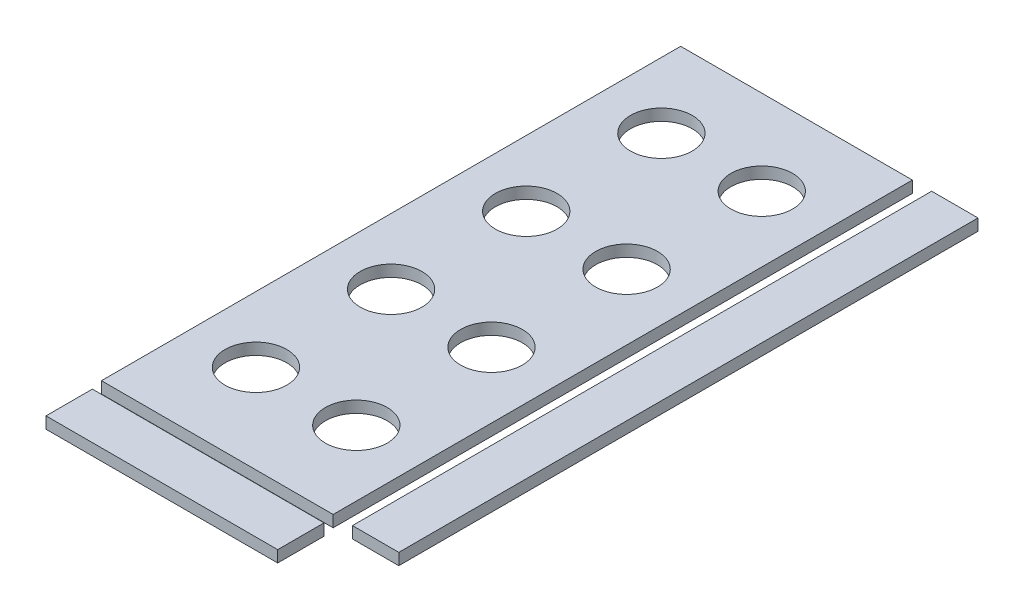
from build123d import *

# Parameters (mm, degrees)
SKETCH1_W             = 60
SKETCH1_H             = 150
BOSS_EXTRUDE2_DEPTH   = 3
SKETCH2_W             = 12
SKETCH2_H             = 150
BOSS_EXTRUDE4_DEPTH   = 3
SKETCH3_W             = 12
SKETCH3_H             = 60
BOSS_EXTRUDE5_DEPTH   = 3
SKETCH4_R             = 8
CUT_EXTRUDE1_DEPTH    = 3
BODY_MOVE_COPY1_ANGLE = 90


with BuildPart() as part:
    # Sketch1 → Boss-Extrude2 (new body)
    with BuildSketch(Plane(origin=(0, 0, 0), x_dir=(1, 0, 0), z_dir=(0, 1, 0))):
        with Locations((-8.377535101, 62.644305772)):
            Rectangle(SKETCH1_W, SKETCH1_H)
    extrude(amount=BOSS_EXTRUDE2_DEPTH)

    # Sketch4 → Cut-Extrude1 (cut)
    with BuildSketch(Plane(origin=(0, 3, 0), x_dir=(1, 0, 0), z_dir=(0, 1, 0))):
        with Locations(Location((4.622464899, 10.644305772, 0), (0, 0, 270))):
            Circle(SKETCH4_R)
        with Locations(Location((-21.377535101, 10.644305772, 0), (0, 0, 270))):
            Circle(SKETCH4_R)
        with Locations(Location((4.622464899, 45.644305772, 0), (0, 0, 270))):
            Circle(SKETCH4_R)
        with Locations(Location((-21.377535101, 45.644305772, 0), (0, 0, 270))):
            Circle(SKETCH4_R)
        with Locations(Location((4.622464899, 80.644305772, 0), (0, 0, 270))):
            Circle(SKETCH4_R)
        with Locations(Location((-21.377535101, 80.644305772, 0), (0, 0, 270))):
            Circle(SKETCH4_R)
        with Locations(Location((4.622464899, 115.644305772, 0), (0, 0, 270))):
            Circle(SKETCH4_R)
        with Locations(Location((-21.377535101, 115.644305772, 0), (0, 0, 270))):
            Circle(SKETCH4_R)
    extrude(amount=-CUT_EXTRUDE1_DEPTH, mode=Mode.SUBTRACT)


with BuildPart() as body_2:
    # Sketch2 → Boss-Extrude4 (new body)
    with BuildSketch(Plane(origin=(0, 0, 0), x_dir=(1, 0, 0), z_dir=(0, 1, 0))):
        with Locations((32.622464899, 62.644305772)):
            Rectangle(SKETCH2_W, SKETCH2_H)
    extrude(amount=BOSS_EXTRUDE4_DEPTH)


with BuildPart() as body_3:
    # Sketch3 → Boss-Extrude5 (new body)
    with BuildSketch(Plane(origin=(0, 0, 0), x_dir=(1, 0, 0), z_dir=(0, 1, 0))):
        with Locations((49.622464899, 17.644305772)):
            Rectangle(SKETCH3_W, SKETCH3_H)
    extrude(amount=BOSS_EXTRUDE5_DEPTH)


with BuildPart() as body_3_1:
    # Body-Move/Copy1: moved
    add(body_3.part.rotate(Axis((99.629560174, 0, -43.26681982), (0, 1, 0)), BODY_MOVE_COPY1_ANGLE))


with BuildPart() as body_3_2:
    # Body-Move/Copy2: moved
    add(body_3_1.part.moved(Location((-132.922222744, 0, 14.688570542))))


solid = Compound([part.part, body_2.part, body_3_2.part])
